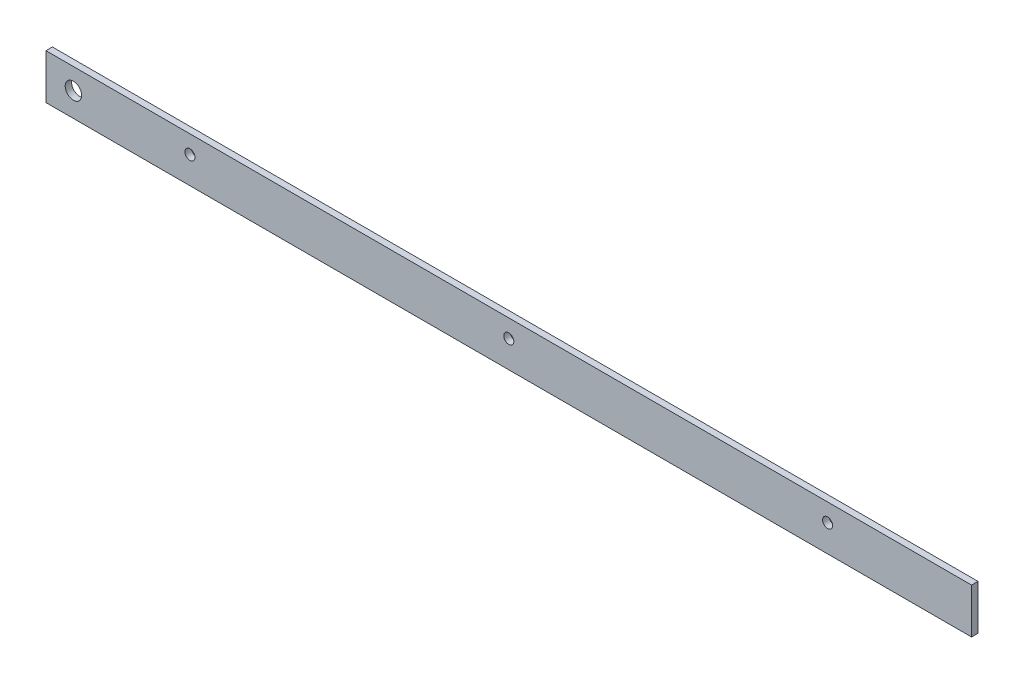
from build123d import *

# Parameters (mm, degrees)
SKETCH1_R           = 2.4892
SKETCH1_R_2         = 4.0635
BOSS_EXTRUDE1_DEPTH = 3.175
SKETCH4_W           = 3.175
SKETCH4_H           = 7.945
BOSS_EXTRUDE3_DEPTH = 24.539999942


with BuildPart() as part:
    # Sketch1 → Boss-Extrude1 (new body)
    with BuildSketch(Plane.XY):
        Polygon((0, -4.833011971), (457.2, -4.833011971), (457.2, 9.446988029), (432.660000058, 9.446988029), (432.660000058, 17.391988029), (419.960000058, 17.391988029), (0, 17.391988029), align=None)
        with Locations((71.12, 8.509488029)):
            Circle(SKETCH1_R, mode=Mode.SUBTRACT)
        with Locations((228.6, 8.509488029)):
            Circle(SKETCH1_R, mode=Mode.SUBTRACT)
        with Locations((386.08, 8.509488029)):
            Circle(SKETCH1_R, mode=Mode.SUBTRACT)
        with Locations((13.54, 7.026988029)):
            Circle(SKETCH1_R_2, mode=Mode.SUBTRACT)
    extrude(amount=BOSS_EXTRUDE1_DEPTH)

    # Sketch4 → Boss-Extrude3 (add)
    with BuildSketch(Plane(origin=(432.660000058, 0, 0), x_dir=(0, 0, -1), z_dir=(1, 0, 0))):
        with Locations((-1.5875, 13.419488029)):
            Rectangle(SKETCH4_W, SKETCH4_H)
    extrude(amount=BOSS_EXTRUDE3_DEPTH)


solid = part.part
